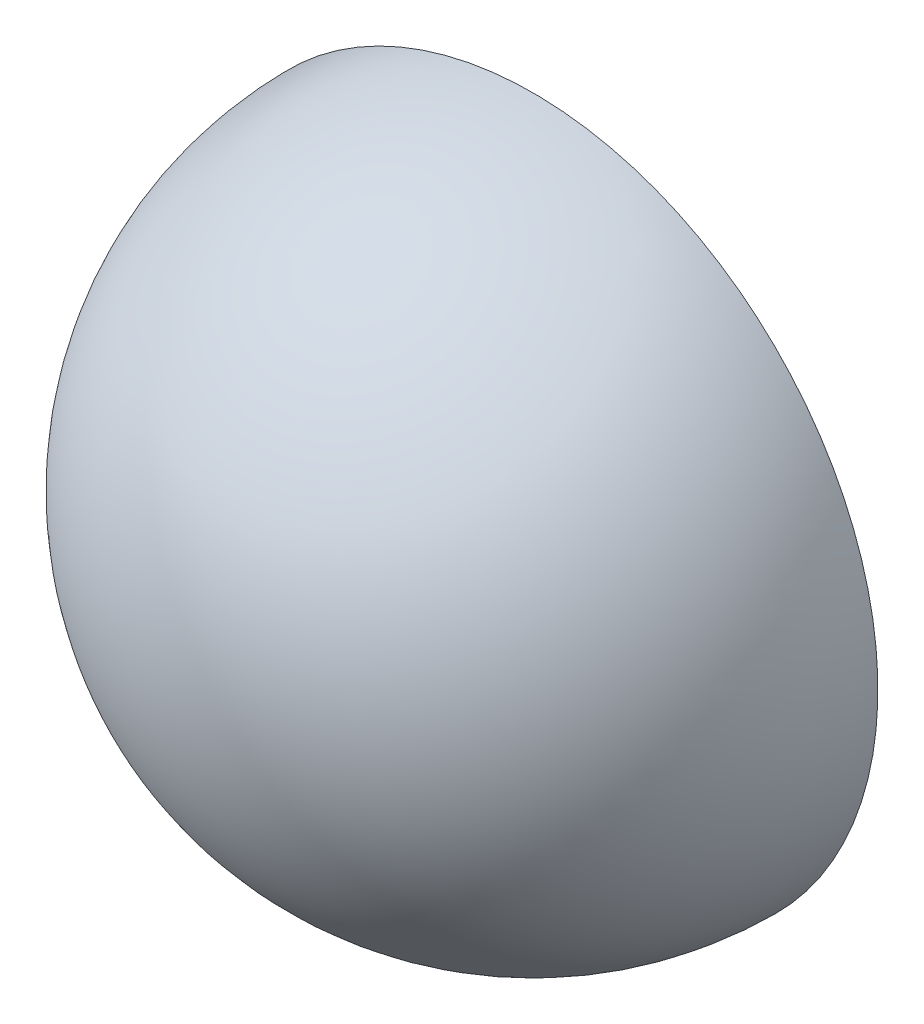
from build123d import *

# Parameters (mm, degrees)
REVOLVE_1_ANGLE = 180


with BuildPart() as part:
    # 草图1 → 旋转1 (revolve)
    with BuildSketch(Plane.XY):
        with BuildLine():
            Line((0, 2.5), (0, -2.5))
            ThreePointArc((0, -2.5), (2.5, 0), (0, 2.5))
        make_face()
    revolve(axis=Axis((0, 2.5, 0), (0, -1, 0)), revolution_arc=REVOLVE_1_ANGLE)


solid = part.part
